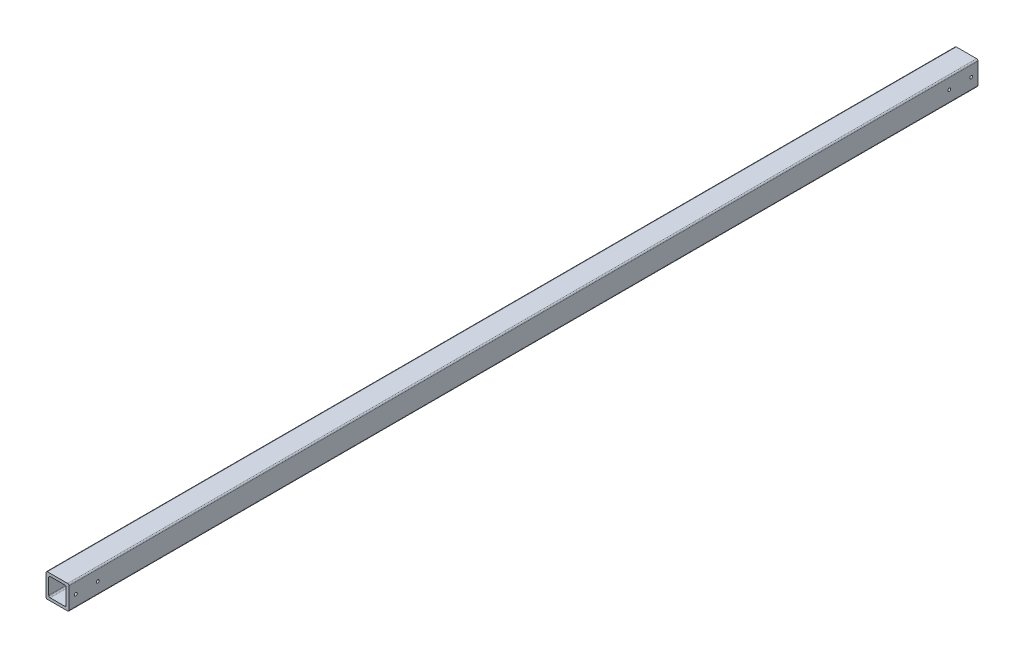
from build123d import *

# Parameters (mm, degrees)
MAIN_W                         = 46.736
MAIN_H                         = 1689.1
EXTRUDE_MAIN_DEPTH             = 44.45
MAIN_CUT_W                     = 32.258
MAIN_CUT_H                     = 34.29
CUT_MAIN_DEPTH                 = 1690.846346839
SKETCH1_W                      = 3.937
SKETCH1_H                      = 44.45
CUT_EXTRUDE1_DEPTH             = 1690.846346839
F_4_0_209_DIAMETER_HOLE2_D     = 5.3086
F_4_0_209_DIAMETER_HOLE2_DEPTH = 5.461
FILLET1_R                      = 2.54


with BuildPart() as part:
    # Main → Extrude-Main (new body)
    with BuildSketch(Plane(origin=(0, 0, 0), x_dir=(1, 0, 0), z_dir=(0, 1, 0))):
        Rectangle(MAIN_W, MAIN_H)
    extrude(amount=EXTRUDE_MAIN_DEPTH)

    # Main Cut → Cut-Main (cut, through all)
    with BuildSketch(Plane.XY.offset(844.55)):
        with Locations((-2.159, 22.225)):
            Rectangle(MAIN_CUT_W, MAIN_CUT_H)
    extrude(amount=-CUT_MAIN_DEPTH, mode=Mode.SUBTRACT)

    # Sketch1 → Cut-Extrude1 (cut, through all)
    with BuildSketch(Plane.XY.offset(844.55)):
        with Locations((21.3995, 22.225)):
            Rectangle(SKETCH1_W, SKETCH1_H)
    extrude(amount=-CUT_EXTRUDE1_DEPTH, mode=Mode.SUBTRACT)

    # #4 (0.209) Diameter Hole2
    with Locations(Plane.ZY.offset(-13.97)):
        with Locations((831.85, 22.225), (-831.85, 22.225), (-791.21, 22.225), (791.21, 22.225)):
            Hole(F_4_0_209_DIAMETER_HOLE2_D / 2, depth=F_4_0_209_DIAMETER_HOLE2_DEPTH)

    # Fillet1
    fillet1_edges = [part.edges().sort_by_distance(p)[0] for p in [
        (-23.368, 44.45, 0),
        (-18.288, 5.08, 0),
        (-18.288, 39.37, 0),
        (13.97, 39.37, 0),
        (13.97, 5.08, 0),
        (19.431, 0, 0),
        (19.431, 44.45, 0),
        (-23.368, 0, 0),
    ]]
    fillet(fillet1_edges, radius=FILLET1_R)


solid = part.part
